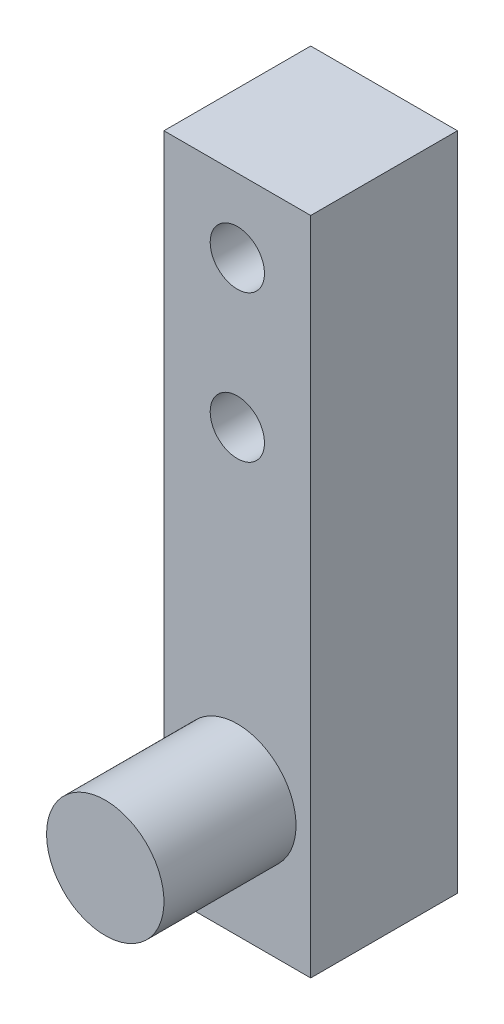
from build123d import *

# Parameters (mm, degrees)
ESQUISSE1_W        = 10
ESQUISSE1_H        = 10
BOSS_EXTRU_1_DEPTH = 20
D_GAGEMENT_M3_51_D = 3.7
ESQUISSE2_W        = 10
ESQUISSE2_H        = 10
BOSS_EXTRU_2_DEPTH = 25
ESQUISSE4_R        = 4
BOSS_EXTRU_3_DEPTH = 9


with BuildPart() as part:
    # Esquisse1 → Boss.-Extru.1 (new body)
    with BuildSketch(Plane(origin=(0, 0, 0), x_dir=(1, 0, 0), z_dir=(0, 1, 0))):
        Rectangle(ESQUISSE1_W, ESQUISSE1_H)
    extrude(amount=BOSS_EXTRU_1_DEPTH)

    # Dégagement M3.51 (through all)
    with Locations(Plane(origin=(0, 0, -5), x_dir=(-1, 0, 0), z_dir=(0, 0, -1))):
        with Locations((0, 15), (0, 5)):
            Hole(D_GAGEMENT_M3_51_D / 2)

    # Esquisse2 → Boss.-Extru.2 (add)
    with BuildSketch(Plane.XZ):
        Rectangle(ESQUISSE2_W, ESQUISSE2_H)
    extrude(amount=BOSS_EXTRU_2_DEPTH)

    # Esquisse4 → Boss.-Extru.3 (add)
    with BuildSketch(Plane(origin=(0, -15, 5), x_dir=(1, 0, 0), z_dir=(0, 0, -1))):
        with Locations(Location((0, 1.5, 0), (0, 0, 180))):
            Circle(ESQUISSE4_R)
    extrude(amount=-BOSS_EXTRU_3_DEPTH)


solid = part.part
